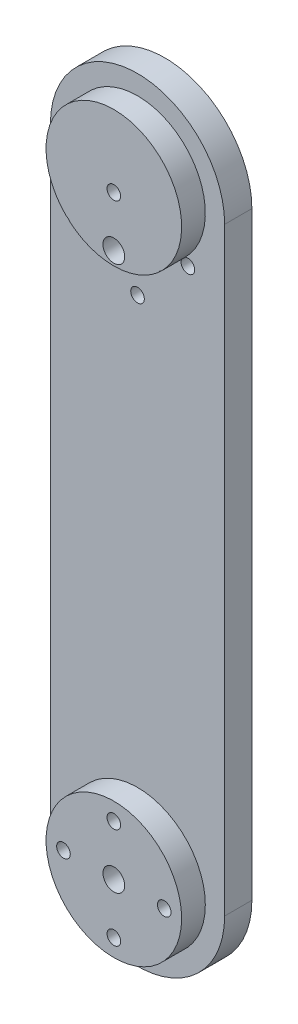
from build123d import *

# Parameters (mm, degrees)
SKETCH_1_R               = 24.9
EXTRUDE_1_DEPTH          = 8.7
EXTRUDE_2_DEPTH          = 10
SKETCH_5_R               = 24.9
EXTRUDE_4_DEPTH          = 8.7
CUT_EXTRUDE_1_DEPTH      = 255.710993088
CUT_EXTRUDE_1_DEPTH_BACK = 255.710993088
SKETCH_2_R               = 4
SKETCH_2_R_2             = 2.5


with BuildPart() as part:
    # 草图1 → 凸台-拉伸1 (new body)
    with BuildSketch(Plane.XY):
        Circle(SKETCH_1_R)
    extrude(amount=EXTRUDE_1_DEPTH)

    # 草图3 → 凸台-拉伸2 (add)
    with BuildSketch(Plane(origin=(0, 0, 0), x_dir=(-1, 0, 0), z_dir=(0, 0, -1))):
        with BuildLine():
            Line((-32, 0), (-32, 220))
            ThreePointArc((-32, 220), (0, 252), (32, 220))
            Line((32, 220), (32, 0))
            ThreePointArc((32, 0), (0, -32), (-32, 0))
        make_face()
    extrude(amount=EXTRUDE_2_DEPTH)

    # 草图5 → 凸台-拉伸4 (add)
    with BuildSketch(Plane.XY):
        with Locations(Location((0, 220, 0), (0, 0, 180))):
            Circle(SKETCH_5_R)
    extrude(amount=EXTRUDE_4_DEPTH)

    # 草图2 → 切除-拉伸1 (cut, two sides: drawn at the far end of the back side and taken through both)
    with BuildSketch(Plane.XY.offset(8.7).offset(-CUT_EXTRUDE_1_DEPTH_BACK)):
        Circle(SKETCH_2_R)
        with Locations((0, 18.5)):
            Circle(SKETCH_2_R_2)
        with Locations((-18.5, 0)):
            Circle(SKETCH_2_R_2)
        with Locations((18.5, 0)):
            Circle(SKETCH_2_R_2)
        with Locations((0, -18.5)):
            Circle(SKETCH_2_R_2)
        with Locations((0, 218.5)):
            Circle(SKETCH_2_R_2)
        with Locations((0, 200)):
            Circle(SKETCH_2_R)
        with Locations((0, 181.5)):
            Circle(SKETCH_2_R_2)
        with Locations((-18.5, 200)):
            Circle(SKETCH_2_R_2)
        with Locations((18.5, 200)):
            Circle(SKETCH_2_R_2)
    extrude(amount=CUT_EXTRUDE_1_DEPTH + CUT_EXTRUDE_1_DEPTH_BACK, mode=Mode.SUBTRACT)


solid = part.part
